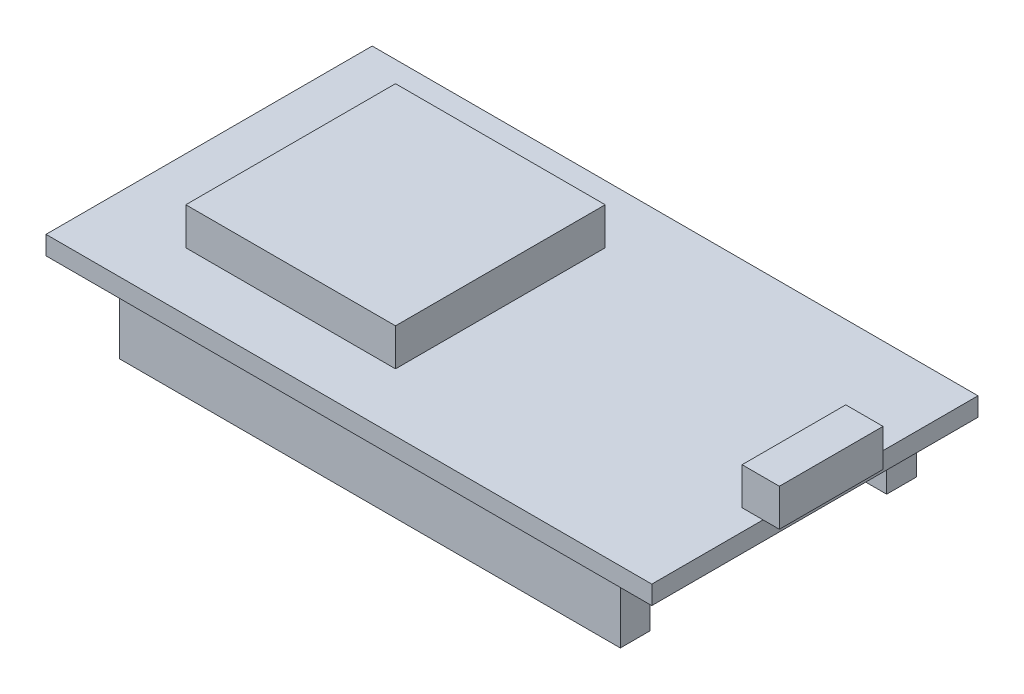
from build123d import *

# Parameters (mm, degrees)
SKETCH1_W           = 52
SKETCH1_H           = 28
BOSS_EXTRUDE1_DEPTH = 1.6
SKETCH2_W           = 18
SKETCH2_H           = 18
BOSS_EXTRUDE2_DEPTH = 3.2
SKETCH3_W           = 3.2
SKETCH3_H           = 8.9
BOSS_EXTRUDE3_DEPTH = 3.2
SKETCH4_W           = 43
SKETCH4_H           = 2.54
BOSS_EXTRUDE4_DEPTH = 5.8


with BuildPart() as part:
    # Sketch1 → Boss-Extrude1 (new body)
    with BuildSketch(Plane(origin=(0, 9, 0), x_dir=(1, 0, 0), z_dir=(0, 1, 0))):
        with Locations((35, 0)):
            Rectangle(SKETCH1_W, SKETCH1_H)
    extrude(amount=BOSS_EXTRUDE1_DEPTH)

    # Sketch2 → Boss-Extrude2 (add)
    with BuildSketch(Plane(origin=(0, 10.6, 0), x_dir=(1, 0, 0), z_dir=(0, 1, 0))):
        with Locations((25, 0)):
            Rectangle(SKETCH2_W, SKETCH2_H)
    extrude(amount=BOSS_EXTRUDE2_DEPTH)

    # Sketch3 → Boss-Extrude3 (add)
    with BuildSketch(Plane(origin=(0, 10.6, 0), x_dir=(1, 0, 0), z_dir=(0, 1, 0))):
        with Locations((60.8, 0)):
            Rectangle(SKETCH3_W, SKETCH3_H)
    extrude(amount=BOSS_EXTRUDE3_DEPTH)

    # Sketch4 → Boss-Extrude4 (add)
    with BuildSketch(Plane(origin=(0, 9, 0), x_dir=(1, 0, 0), z_dir=(0, 1, 0))):
        with Locations((35.5, 11.43)):
            Rectangle(SKETCH4_W, SKETCH4_H)
        with Locations((35.5, -11.43)):
            Rectangle(SKETCH4_W, SKETCH4_H)
    extrude(amount=-BOSS_EXTRUDE4_DEPTH)


solid = part.part
